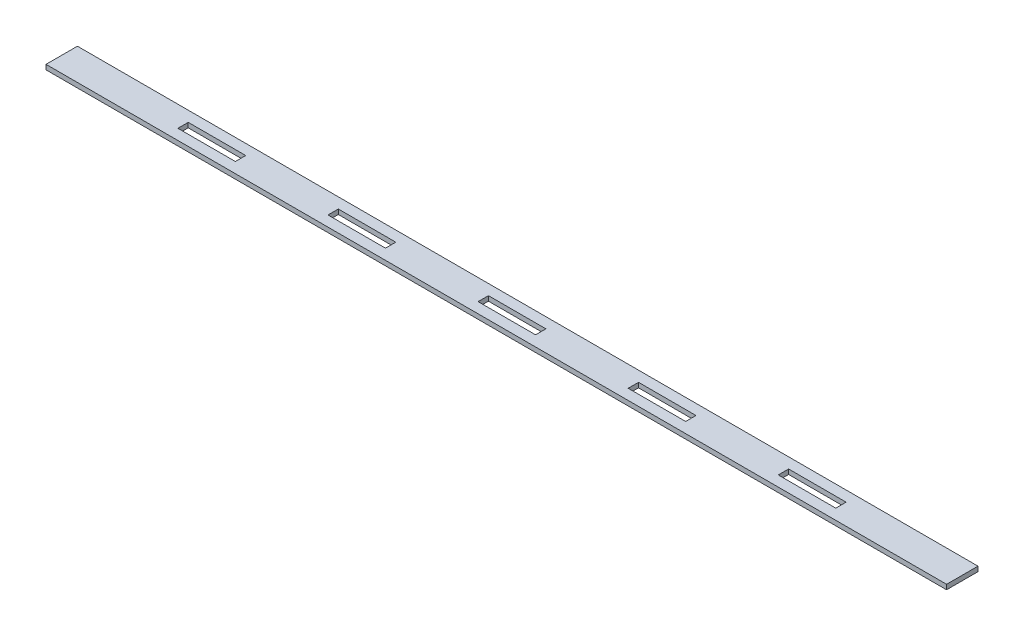
from build123d import *

# Parameters (mm, degrees)
SKETCH1_W           = 596.9
SKETCH1_H           = 20.828
BOSS_EXTRUDE1_DEPTH = 3.175
SKETCH5_W           = 38.1
SKETCH5_H           = 6.858
CUT_EXTRUDE2_DEPTH  = 299.648513341


with BuildPart() as part:
    # Sketch1 → Boss-Extrude1 (new body)
    with BuildSketch(Plane(origin=(0, 0, 0), x_dir=(1, 0, 0), z_dir=(0, 1, 0))):
        Rectangle(SKETCH1_W, SKETCH1_H)
    extrude(amount=BOSS_EXTRUDE1_DEPTH)

    # Sketch5 → Cut-Extrude2 (cut, through all)
    with BuildSketch(Plane(origin=(0, 3.175, 0), x_dir=(1, 0, 0), z_dir=(0, 1, 0))):
        with Locations((-198.966666582, 0)):
            Rectangle(SKETCH5_W, SKETCH5_H)
        with Locations((-99.483333164, 0)):
            Rectangle(SKETCH5_W, SKETCH5_H)
        with Locations((1.69e-07, 0)):
            Rectangle(SKETCH5_W, SKETCH5_H)
        with Locations((99.483333333, 0)):
            Rectangle(SKETCH5_W, SKETCH5_H)
        with Locations((198.966666667, 0)):
            Rectangle(SKETCH5_W, SKETCH5_H)
    extrude(amount=-CUT_EXTRUDE2_DEPTH, mode=Mode.SUBTRACT)


solid = part.part
